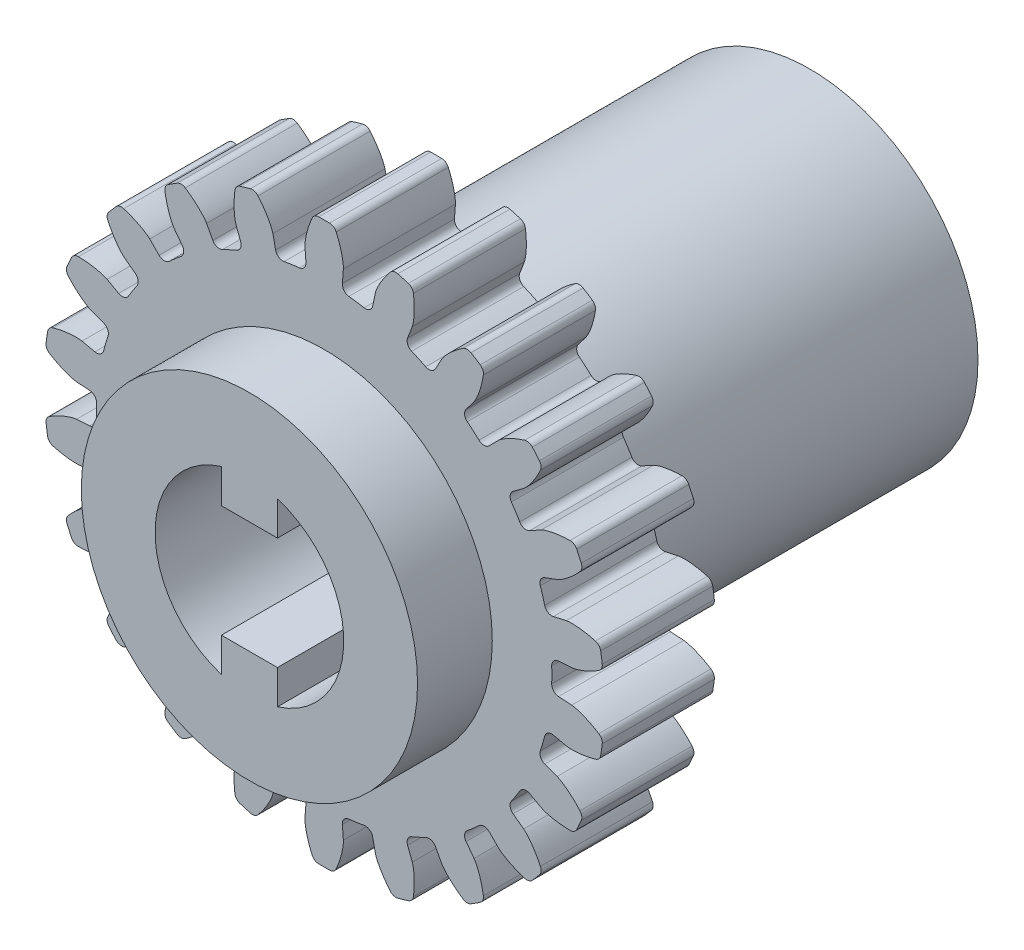
from build123d import *

# Parameters (mm, degrees)
SKETCH1_R                = 15
BOSS_EXTRUDE1_DEPTH      = 6
CUT_EXTRUDE1_DEPTH       = 23.045407685
FILLET1_R                = 0.393380952
CIRPATTERN1_COUNT        = 22
FILLET1_OF_CIRPATTERN1_R = 0.393380952
BOSS_EXTRUDE2_DEPTH      = 10
BOSS_EXTRUDE2_DEPTH_BACK = 20
SKETCH4_R                = 9
CUT_EXTRUDE2_DEPTH       = 30.097831886
CUT_EXTRUDE2_DEPTH_BACK  = 30.097831886


with BuildPart() as part:
    # Sketch1 → Boss-Extrude1 (new body)
    with BuildSketch(Plane.XY):
        Circle(SKETCH1_R)
    extrude(amount=BOSS_EXTRUDE1_DEPTH)

    # Sketch2 → Cut-Extrude1 (cut, through all)
    with BuildSketch(Plane.XY.offset(6)):
        with BuildLine():
            Line((12.16156466, 0.794670547), (13.253216751, 0.866002139))
            add(Edge.make_bspline(
                [(13.253216751, 0.866002139), (13.255914444, 0.86620852), (13.263474218, 0.866880195), (13.277739642, 0.868516575), (13.30097514, 0.871707102), (13.330515261, 0.876537038), (13.368614078, 0.883657416), (13.413382125, 0.893173554), (13.462454053, 0.904812767), (13.515695893, 0.918749707), (13.568675459, 0.933779607), (13.621390614, 0.949819773), (13.673776952, 0.966742157), (13.737076541, 0.988355069), (13.812755257, 1.015819503), (13.900866038, 1.050174504), (14.000372931, 1.0917951), (14.101307947, 1.13705027), (14.200224855, 1.18391075), (14.299678297, 1.233930441), (14.395556748, 1.284220907), (14.494615468, 1.339189637), (14.585783721, 1.391318403), (14.687311571, 1.452738768), (14.769068226, 1.503186874), (14.852992917, 1.557811145), (14.893760691, 1.584767509), (14.914561972, 1.598699838)],
                knots=[0, 0, 0, 0, 0, 0.005376749, 0.015083688, 0.02853182, 0.04661014, 0.064854849, 0.092110526, 0.119476176, 0.146842496, 0.174208854, 0.201574956, 0.228941013, 0.256307345, 0.307035032, 0.361767352, 0.416499661, 0.471231937, 0.525964282, 0.580696616, 0.635428982, 0.690161387, 0.744893688, 0.799626082, 0.854358407, 0.909090914, 0.909090914, 0.909090914, 0.909090914, 0.909090914], degree=4))
            ThreePointArc((14.914561972, 1.598699838), (15.027225848, 0), (14.914561972, -1.598699838))
            add(Edge.make_bspline(
                [(13.253216751, -0.866002139), (13.255914444, -0.86620852), (13.263474218, -0.866880195), (13.277739642, -0.868516575), (13.30097514, -0.871707102), (13.330515261, -0.876537038), (13.368614078, -0.883657416), (13.413382125, -0.893173554), (13.462454053, -0.904812767), (13.515695893, -0.918749707), (13.568675459, -0.933779607), (13.621390614, -0.949819773), (13.673776952, -0.966742157), (13.737076541, -0.988355069), (13.812755257, -1.015819503), (13.900866038, -1.050174504), (14.000372931, -1.0917951), (14.101307947, -1.13705027), (14.200224855, -1.18391075), (14.299678297, -1.233930441), (14.395556748, -1.284220907), (14.494615468, -1.339189637), (14.585783721, -1.391318403), (14.687311571, -1.452738768), (14.769068226, -1.503186874), (14.852992917, -1.557811145), (14.893760691, -1.584767509), (14.914561972, -1.598699838)],
                knots=[0, 0, 0, 0, 0, 0.005376749, 0.015083688, 0.02853182, 0.04661014, 0.064854849, 0.092110526, 0.119476176, 0.146842496, 0.174208854, 0.201574956, 0.228941013, 0.256307345, 0.307035032, 0.361767352, 0.416499661, 0.471231937, 0.525964282, 0.580696616, 0.635428982, 0.690161387, 0.744893688, 0.799626082, 0.854358407, 0.909090914, 0.909090914, 0.909090914, 0.909090914, 0.909090914], degree=4))
            Line((13.253216751, -0.866002139), (12.16156466, -0.794670547))
            ThreePointArc((12.16156466, -0.794670547), (12.1875, 0), (12.16156466, 0.794670547))
        make_face()
    cut_extrude1 = extrude(amount=-CUT_EXTRUDE1_DEPTH, mode=Mode.SUBTRACT)

    # Fillet1
    fillet1_edges = [part.edges().sort_by_distance(p)[0] for p in [
        (12.16156466, -0.794670547, 3),
        (12.16156466, 0.794670547, 3),
        (14.914561972, 1.598699838, 3),
        (14.914561972, -1.598699838, 3),
    ]]
    fillet(fillet1_edges, radius=FILLET1_R)

    # CirPattern1: Cut-Extrude1 ×22 about axis
    cirpattern1_axis = Axis((0, 0, 0), (0, 0, 1))
    for i in range(1, CIRPATTERN1_COUNT):
        add(cut_extrude1.rotate(cirpattern1_axis, i * 360 / CIRPATTERN1_COUNT), mode=Mode.SUBTRACT)

    # Fillet1 of CirPattern1
    fillet1_of_cirpattern1_edges = [part.edges().sort_by_distance(p)[0] for p in [
        (11.892820404, 2.6638279, 3),
        (11.445051274, 4.188789513, 3),
        (13.860011624, 5.73585894, 3),
        (14.76082321, 2.667976417, 3),
        (10.660590569, 5.906518854, 3),
        (9.8013279, 7.243557664, 3),
        (11.682605562, 9.408332864, 3),
        (13.411250337, 6.71850909, 3),
        (8.564703087, 8.670698777, 3),
        (7.363559231, 9.711495853, 3),
        (8.558744277, 12.318599612, 3),
        (10.975177722, 10.224748113, 3),
        (5.774954297, 10.732430252, 3),
        (4.329238786, 11.392666404, 3),
        (4.741504432, 14.230886681, 3),
        (7.64996148, 12.902638853, 3),
        (2.517353055, 11.924684057, 3),
        (0.944189161, 12.150870877, 3),
        (0.540136096, 14.990271945, 3),
        (3.704990854, 14.535234528, 3),
        (-0.944189161, 12.150870877, 3),
        (-2.517353055, 11.924684057, 3),
        (-3.704990854, 14.535234528, 3),
        (-0.540136096, 14.990271945, 3),
        (-4.329238786, 11.392666404, 3),
        (-5.774954297, 10.732430252, 3),
        (-7.64996148, 12.902638853, 3),
        (-4.741504432, 14.230886681, 3),
        (-7.363559231, 9.711495853, 3),
        (-8.564703087, 8.670698777, 3),
        (-10.975177722, 10.224748113, 3),
        (-8.558744277, 12.318599612, 3),
        (-9.8013279, 7.243557664, 3),
        (-10.660590569, 5.906518854, 3),
        (-13.411250337, 6.71850909, 3),
        (-11.682605562, 9.408332864, 3),
        (-11.445051274, 4.188789513, 3),
        (-11.892820404, 2.6638279, 3),
        (-14.76082321, 2.667976417, 3),
        (-13.860011624, 5.73585894, 3),
        (-12.16156466, 0.794670547, 3),
        (-12.16156466, -0.794670547, 3),
        (-14.914561972, -1.598699838, 3),
        (-14.914561972, 1.598699838, 3),
        (-11.892820404, -2.6638279, 3),
        (-11.445051274, -4.188789513, 3),
        (-13.860011624, -5.73585894, 3),
        (-14.76082321, -2.667976417, 3),
        (-10.660590569, -5.906518854, 3),
        (-9.8013279, -7.243557664, 3),
        (-11.682605562, -9.408332864, 3),
        (-13.411250337, -6.71850909, 3),
        (-8.564703087, -8.670698777, 3),
        (-7.363559231, -9.711495853, 3),
        (-8.558744277, -12.318599612, 3),
        (-10.975177722, -10.224748113, 3),
        (-5.774954297, -10.732430252, 3),
        (-4.329238786, -11.392666404, 3),
        (-4.741504432, -14.230886681, 3),
        (-7.64996148, -12.902638853, 3),
        (-2.517353055, -11.924684057, 3),
        (-0.944189161, -12.150870877, 3),
        (-0.540136096, -14.990271945, 3),
        (-3.704990854, -14.535234528, 3),
        (0.944189161, -12.150870877, 3),
        (2.517353055, -11.924684057, 3),
        (3.704990854, -14.535234528, 3),
        (0.540136096, -14.990271945, 3),
        (4.329238786, -11.392666404, 3),
        (5.774954297, -10.732430252, 3),
        (7.64996148, -12.902638853, 3),
        (4.741504432, -14.230886681, 3),
        (7.363559231, -9.711495853, 3),
        (8.564703087, -8.670698777, 3),
        (10.975177722, -10.224748113, 3),
        (8.558744277, -12.318599612, 3),
        (9.8013279, -7.243557664, 3),
        (10.660590569, -5.906518854, 3),
        (13.411250337, -6.71850909, 3),
        (11.682605562, -9.408332864, 3),
        (11.445051274, -4.188789513, 3),
        (11.892820404, -2.6638279, 3),
        (14.76082321, -2.667976417, 3),
        (13.860011624, -5.73585894, 3),
    ]]
    fillet(fillet1_of_cirpattern1_edges, radius=FILLET1_OF_CIRPATTERN1_R)

    # Sketch4 → Boss-Extrude2 (add, two sides: drawn at the far end of the back side and taken through both)
    with BuildSketch(Plane.XY.offset(-BOSS_EXTRUDE2_DEPTH_BACK)):
        Circle(SKETCH4_R)
    extrude(amount=BOSS_EXTRUDE2_DEPTH + BOSS_EXTRUDE2_DEPTH_BACK)

    # Sketch3 → Cut-Extrude2 (cut, two sides: drawn at the far end of the back side and taken through both)
    with BuildSketch(Plane.XY.offset(-CUT_EXTRUDE2_DEPTH_BACK)):
        with BuildLine():
            Line((-1.5, 3), (-1.5, 4.822084611))
            ThreePointArc((-1.5, 4.822084611), (-5.05, 0), (-1.5, -4.822084611))
            Line((-1.5, -4.822084611), (-1.5, -3))
            Line((-1.5, -3), (1.5, -3))
            Line((1.5, -3), (1.5, -4.822084611))
            ThreePointArc((1.5, -4.822084611), (4.0667862, -2.993952237), (5.05, 0))
            ThreePointArc((5.05, 0), (4.0667862, 2.993952237), (1.5, 4.822084611))
            Line((1.5, 4.822084611), (1.5, 3))
            Line((1.5, 3), (-1.5, 3))
        make_face()
    extrude(amount=CUT_EXTRUDE2_DEPTH + CUT_EXTRUDE2_DEPTH_BACK, mode=Mode.SUBTRACT)


solid = part.part
